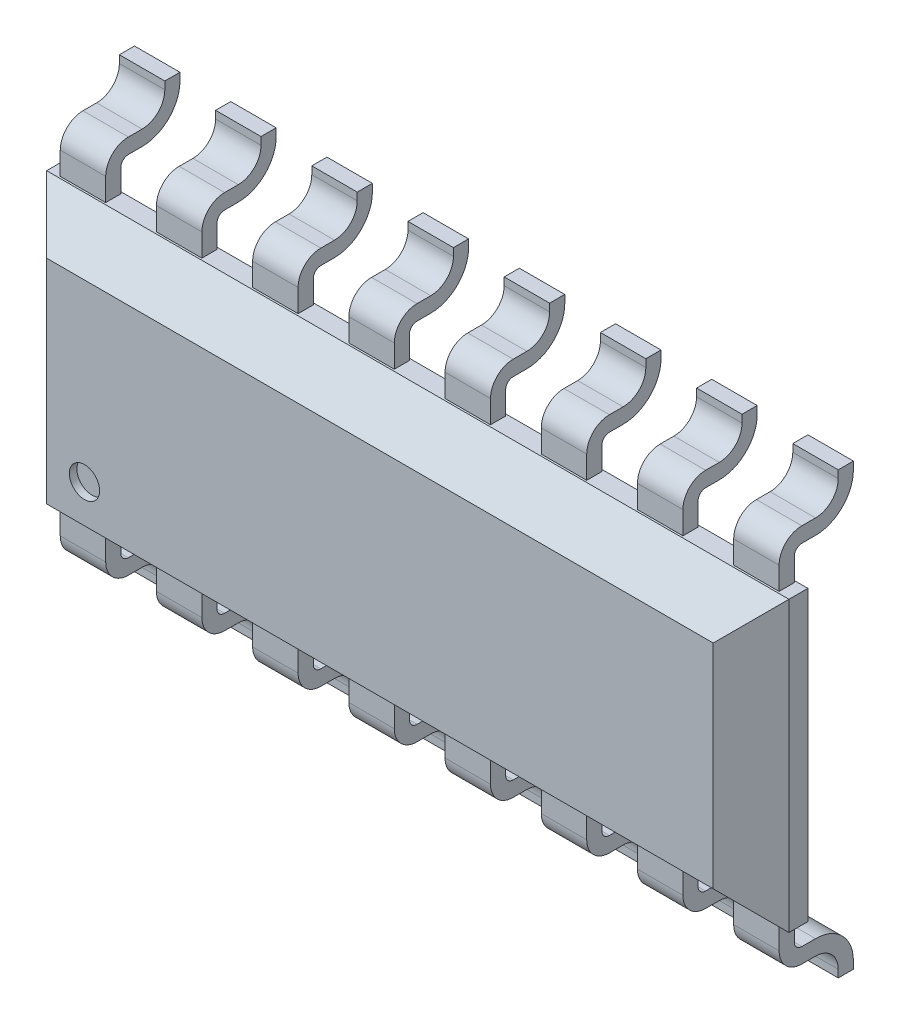
from build123d import *

# Parameters (mm, degrees)
SKETCH_1_W               = 9.8
SKETCH_1_H               = 3.81
EXTRUDE_1_DEPTH          = 1.25
CHAMFER_1_SIZE           = 0.5
SKETCH_2_W               = 0.6
SKETCH_2_H               = 0.2
PATTERN_LINEAR_1_COUNT   = 4
PATTERN_LINEAR_1_PITCH   = 1.27
PATTERN_LINEAR_2_COUNT   = 5
PATTERN_LINEAR_2_PITCH   = 1.27
MIRROR_1_COPY_1_SKETCH_W = 0.6
MIRROR_1_COPY_1_SKETCH_H = 0.2
MIRROR_1_COPY_2_SKETCH_W = 0.6
MIRROR_1_COPY_2_SKETCH_H = 0.2
MIRROR_1_COPY_3_SKETCH_W = 0.6
MIRROR_1_COPY_3_SKETCH_H = 0.2
MIRROR_1_COPY_4_SKETCH_W = 0.6
MIRROR_1_COPY_4_SKETCH_H = 0.2
MIRROR_1_COPY_5_SKETCH_W = 0.6
MIRROR_1_COPY_5_SKETCH_H = 0.2
MIRROR_1_COPY_6_SKETCH_W = 0.6
MIRROR_1_COPY_6_SKETCH_H = 0.2
MIRROR_1_COPY_7_SKETCH_W = 0.6
MIRROR_1_COPY_7_SKETCH_H = 0.2
SKETCH_4_R               = 0.2
CUT_EXTRUDE_1_DEPTH      = 0.1


with BuildPart() as part:
    # 草图1 → 凸台-拉伸1 (new body)
    with BuildSketch(Plane.XY):
        Rectangle(SKETCH_1_W, SKETCH_1_H)
    extrude(amount=EXTRUDE_1_DEPTH)

    # 倒角1
    chamfer_1_edges = [part.edges().sort_by_distance(p)[0] for p in [
        (4.9, 0, 1.25),
        (0, 1.905, 1.25),
        (-4.9, 0, 1.25),
        (0, 1.905, 0),
        (4.9, 0, 0),
        (0, -1.905, 0),
        (-4.9, 0, 0),
        (0, -1.905, 1.25),
    ]]
    chamfer(chamfer_1_edges, length=CHAMFER_1_SIZE)

    # 扫描1: sweep along a path in 草图3
    with BuildLine(Plane(origin=(-0.635, 0, 0), x_dir=(0, 0, -1), z_dir=(1, 0, 0))) as sweep_1_path:
        Line((-0.725, -1.905), (-0.725, -2.205))
        ThreePointArc((-0.725, -2.205), (-0.637132034, -2.417132034), (-0.425, -2.505))
        Line((-0.425, -2.505), (-0.244541172, -2.505))
        ThreePointArc((-0.244541172, -2.505), (-0.032409137, -2.592867966), (0.055458828, -2.805))
        Line((0.055458828, -2.805), (0.055458828, -2.905))
    # 草图2 → 扫描1 (sweep)
    with BuildSketch(Plane.XZ.offset(1.905)):
        with Locations((-0.635, 0.625)):
            Rectangle(SKETCH_2_W, SKETCH_2_H)
    sweep_1 = sweep(path=sweep_1_path.line)

    # 阵列(线性)1: 扫描1 ×4
    with Locations(*[(-i * PATTERN_LINEAR_1_PITCH, 0, 0) for i in range(1, PATTERN_LINEAR_1_COUNT)]):
        add(sweep_1)

    # 阵列(线性)2: 扫描1 ×5
    with Locations(*[(i * PATTERN_LINEAR_2_PITCH, 0, 0) for i in range(1, PATTERN_LINEAR_2_COUNT)]):
        add(sweep_1)

    # 镜向1: 扫描1 across plane
    add(sweep_1.mirror(Plane.ZX))

    # 镜向1 copy 1: sweep along a path in 镜向1 copy 1 path
    with BuildLine(Plane(origin=(-1.905, 0, 0), x_dir=(0, 0, -1), z_dir=(1, 0, 0))) as mirror_1_copy_1_path:
        Line((-0.725, 1.905), (-0.725, 2.205))
        ThreePointArc((-0.725, 2.205), (-0.637132034, 2.417132034), (-0.425, 2.505))
        Line((-0.425, 2.505), (-0.244541172, 2.505))
        ThreePointArc((-0.244541172, 2.505), (-0.032409137, 2.592867966), (0.055458828, 2.805))
        Line((0.055458828, 2.805), (0.055458828, 2.905))
    # 镜向1 copy 1 sketch → 镜向1 copy 1 (sweep)
    with BuildSketch(Plane(origin=(-1.27, 1.905, 0), x_dir=(1, 0, 0), z_dir=(0, 1, 0))):
        with Locations((-0.635, -0.625)):
            Rectangle(MIRROR_1_COPY_1_SKETCH_W, MIRROR_1_COPY_1_SKETCH_H)
    sweep(path=mirror_1_copy_1_path.line)

    # 镜向1 copy 2: sweep along a path in 镜向1 copy 2 path
    with BuildLine(Plane(origin=(-3.175, 0, 0), x_dir=(0, 0, -1), z_dir=(1, 0, 0))) as mirror_1_copy_2_path:
        Line((-0.725, 1.905), (-0.725, 2.205))
        ThreePointArc((-0.725, 2.205), (-0.637132034, 2.417132034), (-0.425, 2.505))
        Line((-0.425, 2.505), (-0.244541172, 2.505))
        ThreePointArc((-0.244541172, 2.505), (-0.032409137, 2.592867966), (0.055458828, 2.805))
        Line((0.055458828, 2.805), (0.055458828, 2.905))
    # 镜向1 copy 2 sketch → 镜向1 copy 2 (sweep)
    with BuildSketch(Plane(origin=(-2.54, 1.905, 0), x_dir=(1, 0, 0), z_dir=(0, 1, 0))):
        with Locations((-0.635, -0.625)):
            Rectangle(MIRROR_1_COPY_2_SKETCH_W, MIRROR_1_COPY_2_SKETCH_H)
    sweep(path=mirror_1_copy_2_path.line)

    # 镜向1 copy 3: sweep along a path in 镜向1 copy 3 path
    with BuildLine(Plane(origin=(-4.445, 0, 0), x_dir=(0, 0, -1), z_dir=(1, 0, 0))) as mirror_1_copy_3_path:
        Line((-0.725, 1.905), (-0.725, 2.205))
        ThreePointArc((-0.725, 2.205), (-0.637132034, 2.417132034), (-0.425, 2.505))
        Line((-0.425, 2.505), (-0.244541172, 2.505))
        ThreePointArc((-0.244541172, 2.505), (-0.032409137, 2.592867966), (0.055458828, 2.805))
        Line((0.055458828, 2.805), (0.055458828, 2.905))
    # 镜向1 copy 3 sketch → 镜向1 copy 3 (sweep)
    with BuildSketch(Plane(origin=(-3.81, 1.905, 0), x_dir=(1, 0, 0), z_dir=(0, 1, 0))):
        with Locations((-0.635, -0.625)):
            Rectangle(MIRROR_1_COPY_3_SKETCH_W, MIRROR_1_COPY_3_SKETCH_H)
    sweep(path=mirror_1_copy_3_path.line)

    # 镜向1 copy 4: sweep along a path in 镜向1 copy 4 path
    with BuildLine(Plane(origin=(0.635, 0, 0), x_dir=(0, 0, -1), z_dir=(1, 0, 0))) as mirror_1_copy_4_path:
        Line((-0.725, 1.905), (-0.725, 2.205))
        ThreePointArc((-0.725, 2.205), (-0.637132034, 2.417132034), (-0.425, 2.505))
        Line((-0.425, 2.505), (-0.244541172, 2.505))
        ThreePointArc((-0.244541172, 2.505), (-0.032409137, 2.592867966), (0.055458828, 2.805))
        Line((0.055458828, 2.805), (0.055458828, 2.905))
    # 镜向1 copy 4 sketch → 镜向1 copy 4 (sweep)
    with BuildSketch(Plane(origin=(1.27, 1.905, 0), x_dir=(1, 0, 0), z_dir=(0, 1, 0))):
        with Locations((-0.635, -0.625)):
            Rectangle(MIRROR_1_COPY_4_SKETCH_W, MIRROR_1_COPY_4_SKETCH_H)
    sweep(path=mirror_1_copy_4_path.line)

    # 镜向1 copy 5: sweep along a path in 镜向1 copy 5 path
    with BuildLine(Plane(origin=(1.905, 0, 0), x_dir=(0, 0, -1), z_dir=(1, 0, 0))) as mirror_1_copy_5_path:
        Line((-0.725, 1.905), (-0.725, 2.205))
        ThreePointArc((-0.725, 2.205), (-0.637132034, 2.417132034), (-0.425, 2.505))
        Line((-0.425, 2.505), (-0.244541172, 2.505))
        ThreePointArc((-0.244541172, 2.505), (-0.032409137, 2.592867966), (0.055458828, 2.805))
        Line((0.055458828, 2.805), (0.055458828, 2.905))
    # 镜向1 copy 5 sketch → 镜向1 copy 5 (sweep)
    with BuildSketch(Plane(origin=(2.54, 1.905, 0), x_dir=(1, 0, 0), z_dir=(0, 1, 0))):
        with Locations((-0.635, -0.625)):
            Rectangle(MIRROR_1_COPY_5_SKETCH_W, MIRROR_1_COPY_5_SKETCH_H)
    sweep(path=mirror_1_copy_5_path.line)

    # 镜向1 copy 6: sweep along a path in 镜向1 copy 6 path
    with BuildLine(Plane(origin=(3.175, 0, 0), x_dir=(0, 0, -1), z_dir=(1, 0, 0))) as mirror_1_copy_6_path:
        Line((-0.725, 1.905), (-0.725, 2.205))
        ThreePointArc((-0.725, 2.205), (-0.637132034, 2.417132034), (-0.425, 2.505))
        Line((-0.425, 2.505), (-0.244541172, 2.505))
        ThreePointArc((-0.244541172, 2.505), (-0.032409137, 2.592867966), (0.055458828, 2.805))
        Line((0.055458828, 2.805), (0.055458828, 2.905))
    # 镜向1 copy 6 sketch → 镜向1 copy 6 (sweep)
    with BuildSketch(Plane(origin=(3.81, 1.905, 0), x_dir=(1, 0, 0), z_dir=(0, 1, 0))):
        with Locations((-0.635, -0.625)):
            Rectangle(MIRROR_1_COPY_6_SKETCH_W, MIRROR_1_COPY_6_SKETCH_H)
    sweep(path=mirror_1_copy_6_path.line)

    # 镜向1 copy 7: sweep along a path in 镜向1 copy 7 path
    with BuildLine(Plane(origin=(4.445, 0, 0), x_dir=(0, 0, -1), z_dir=(1, 0, 0))) as mirror_1_copy_7_path:
        Line((-0.725, 1.905), (-0.725, 2.205))
        ThreePointArc((-0.725, 2.205), (-0.637132034, 2.417132034), (-0.425, 2.505))
        Line((-0.425, 2.505), (-0.244541172, 2.505))
        ThreePointArc((-0.244541172, 2.505), (-0.032409137, 2.592867966), (0.055458828, 2.805))
        Line((0.055458828, 2.805), (0.055458828, 2.905))
    # 镜向1 copy 7 sketch → 镜向1 copy 7 (sweep)
    with BuildSketch(Plane(origin=(5.08, 1.905, 0), x_dir=(1, 0, 0), z_dir=(0, 1, 0))):
        with Locations((-0.635, -0.625)):
            Rectangle(MIRROR_1_COPY_7_SKETCH_W, MIRROR_1_COPY_7_SKETCH_H)
    sweep(path=mirror_1_copy_7_path.line)

    # 草图4 → 切除-拉伸1 (cut)
    with BuildSketch(Plane.XY.offset(1.25)):
        with Locations((-3.9, -0.905)):
            Circle(SKETCH_4_R)
    extrude(amount=-CUT_EXTRUDE_1_DEPTH, mode=Mode.SUBTRACT)


solid = part.part
